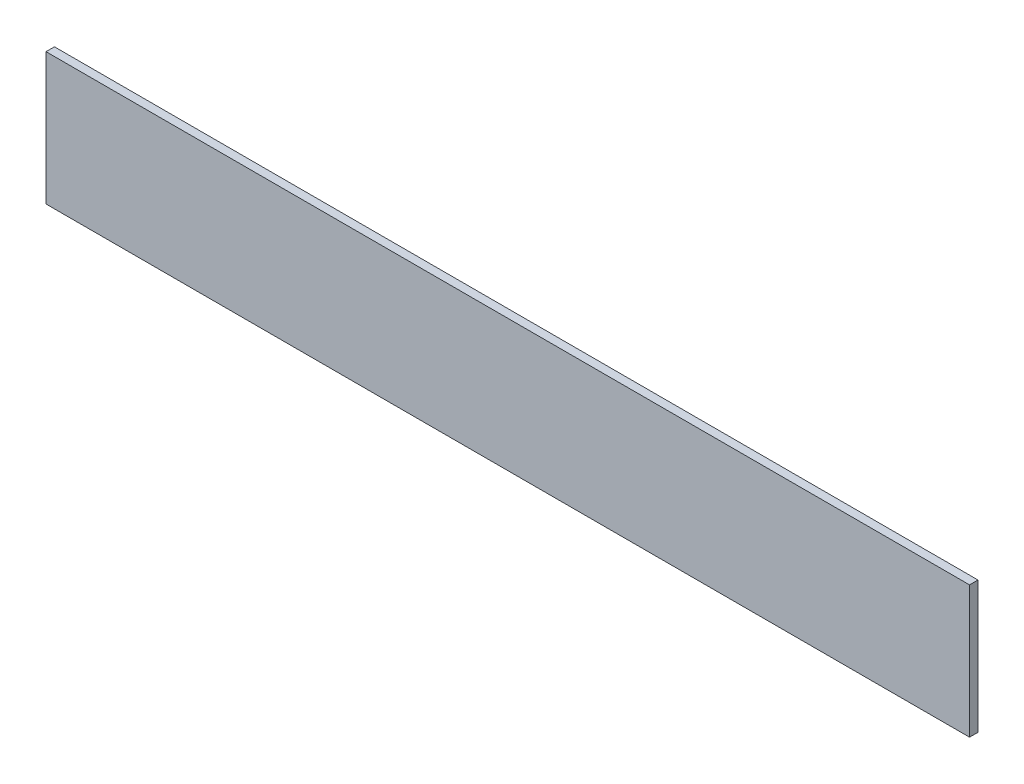
from build123d import *

# Parameters (mm, degrees)
SKETCH1_W           = 175
SKETCH1_H           = 25
BOSS_EXTRUDE1_DEPTH = 0.8


with BuildPart() as part:
    # Sketch1 → Boss-Extrude1 (new, symmetric)
    with BuildSketch(Plane.XY):
        Rectangle(SKETCH1_W, SKETCH1_H)
    extrude(amount=BOSS_EXTRUDE1_DEPTH, both=True)


solid = part.part
